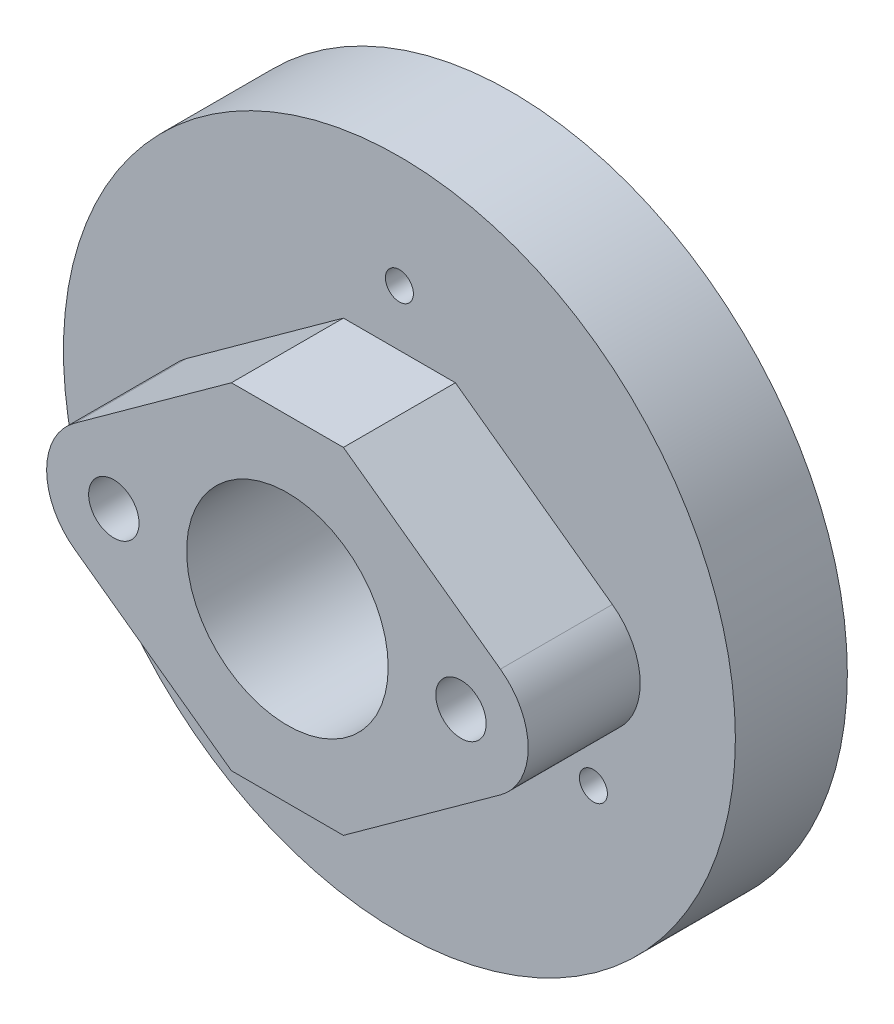
from build123d import *

# Parameters (mm, degrees)
SKETCH_1_R               = 30
SKETCH_1_R_2             = 9
SKETCH_1_R_3             = 1.25
EXTRUDE_1_DEPTH          = 10
SKETCH_3_R               = 9
EXTRUDE_2_DEPTH          = 10
CUT_EXTRUDE_1_DEPTH      = 44.588989435
CUT_EXTRUDE_1_DEPTH_BACK = 44.588989435
SKETCH_2_R               = 2.25
SKETCH_4_R               = 4
CUT_EXTRUDE_2_DEPTH      = 5


with BuildPart() as part:
    # 草图1 → 凸台-拉伸1 (new body)
    with BuildSketch(Plane.XY):
        Circle(SKETCH_1_R)
        Circle(SKETCH_1_R_2, mode=Mode.SUBTRACT)
        with Locations((0, 20)):
            Circle(SKETCH_1_R_3, mode=Mode.SUBTRACT)
        with Locations((17.320508076, -10)):
            Circle(SKETCH_1_R_3, mode=Mode.SUBTRACT)
        with Locations((-17.320508076, -10)):
            Circle(SKETCH_1_R_3, mode=Mode.SUBTRACT)
    extrude(amount=EXTRUDE_1_DEPTH)

    # 草图3 → 凸台-拉伸2 (add)
    with BuildSketch(Plane.XY.offset(10)):
        with BuildLine():
            Line((5, 15), (-5, 15))
            Line((-5, 15), (-19.016468159, 4.861527711))
            ThreePointArc((-19.016468159, 4.861527711), (-21.5, 0), (-19.016468159, -4.861527711))
            Line((-19.016468159, -4.861527711), (-5, -15))
            Line((-5, -15), (5, -15))
            Line((5, -15), (19.016468159, -4.861527711))
            ThreePointArc((19.016468159, -4.861527711), (21.5, 0), (19.016468159, 4.861527711))
            Line((19.016468159, 4.861527711), (5, 15))
        make_face()
        Circle(SKETCH_3_R, mode=Mode.SUBTRACT)
    extrude(amount=EXTRUDE_2_DEPTH)

    # 草图2 → 切除-拉伸1 (cut, two sides: drawn at the far end of the back side and taken through both)
    with BuildSketch(Plane.XY.offset(10).offset(-CUT_EXTRUDE_1_DEPTH_BACK)):
        with Locations((-15.5, 0)):
            Circle(SKETCH_2_R)
        with Locations((15.5, 0)):
            Circle(SKETCH_2_R)
    extrude(amount=CUT_EXTRUDE_1_DEPTH + CUT_EXTRUDE_1_DEPTH_BACK, mode=Mode.SUBTRACT)

    # 草图4 → 切除-拉伸2 (cut)
    with BuildSketch(Plane(origin=(0, 0, 0), x_dir=(-1, 0, 0), z_dir=(0, 0, -1))):
        with Locations((-15.5, 0)):
            Circle(SKETCH_4_R)
        with Locations((15.5, 0)):
            Circle(SKETCH_4_R)
    extrude(amount=-CUT_EXTRUDE_2_DEPTH, mode=Mode.SUBTRACT)


solid = part.part
